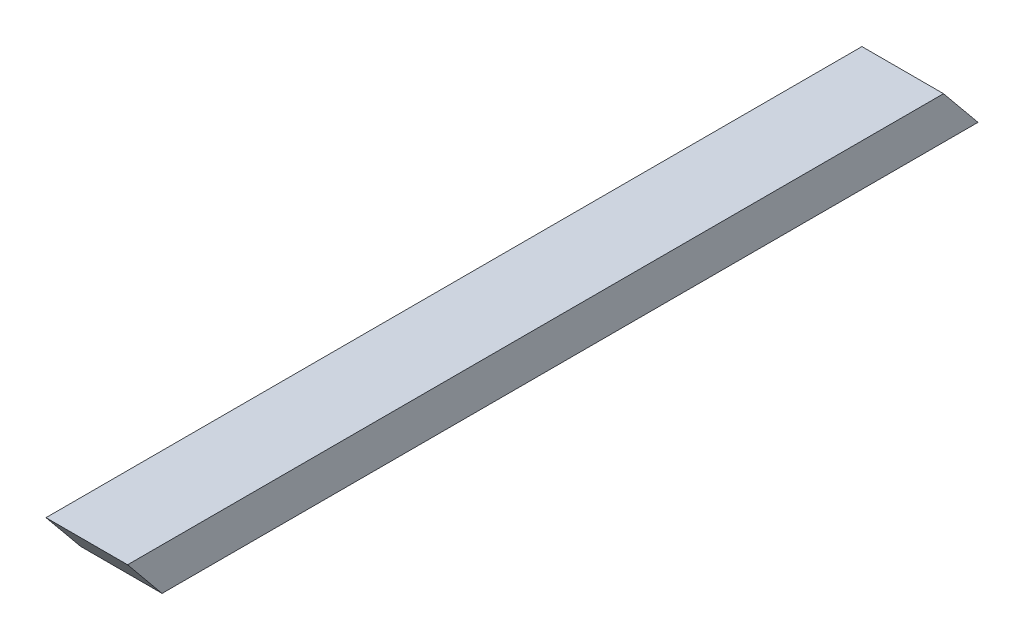
from build123d import *

# Parameters (mm, degrees)
BOSS_EXTRUDE1_DEPTH = 30


with BuildPart() as part:
    # Sketch1 → Boss-Extrude1 (new body)
    with BuildSketch(Plane(origin=(0, 0, 0), x_dir=(0, 0, -1), z_dir=(1, 0, 0))):
        Polygon((-155.941600228, 38.4), (-143.266696889, 22.9291621), (156.733303111, 22.9291621), (144.058399772, 38.4), align=None)
    extrude(amount=BOSS_EXTRUDE1_DEPTH)


solid = part.part
